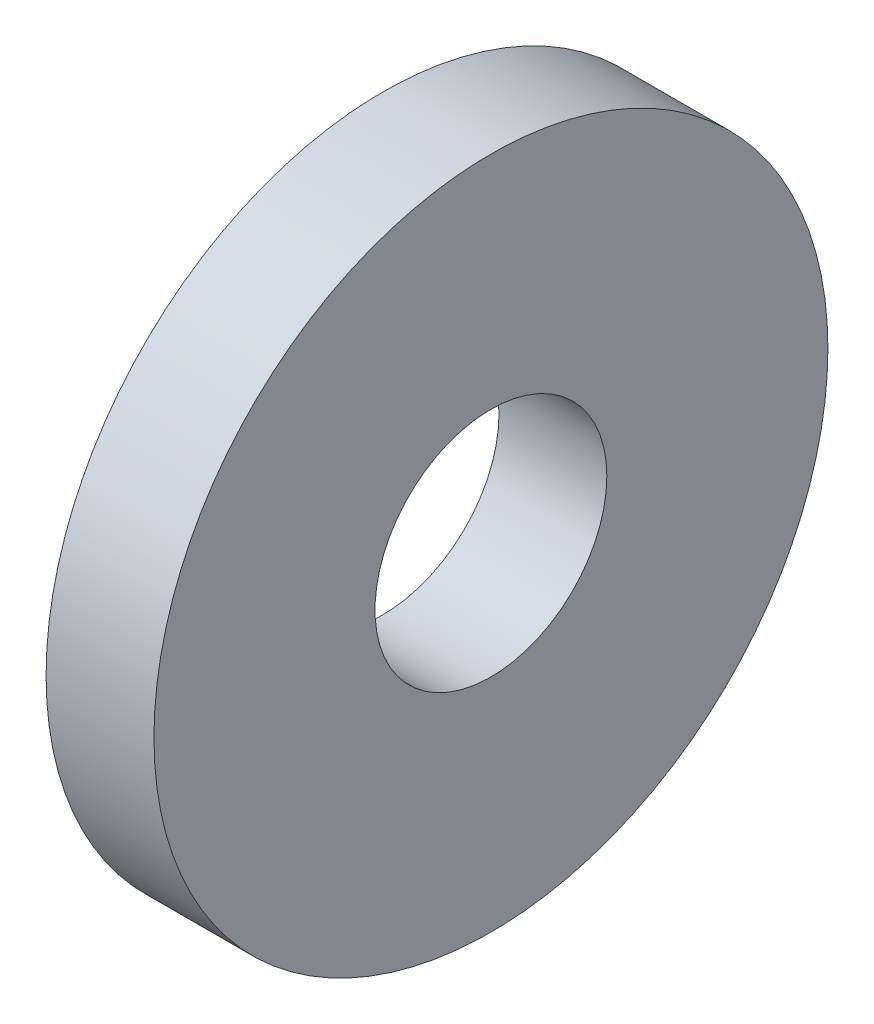
from build123d import *

# Parameters (mm, degrees)
SKETCH1_R           = 6.35
SKETCH1_R_2         = 2.1844
BOSS_EXTRUDE1_DEPTH = 2.032


with BuildPart() as part:
    # Sketch1 → Boss-Extrude1 (new body)
    with BuildSketch(Plane(origin=(0, 0, 0), x_dir=(0, 0, -1), z_dir=(1, 0, 0))):
        Circle(SKETCH1_R)
        Circle(SKETCH1_R_2, mode=Mode.SUBTRACT)
    extrude(amount=BOSS_EXTRUDE1_DEPTH)


solid = part.part
